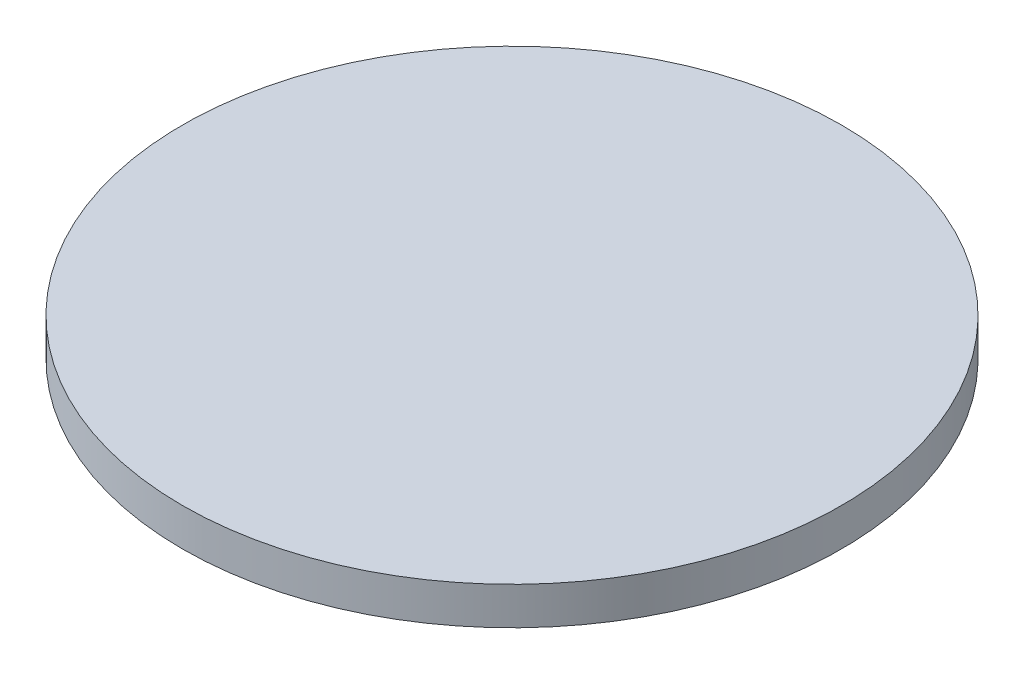
from build123d import *

# Parameters (mm, degrees)
SKETCH1_R           = 87.5
BOSS_EXTRUDE1_DEPTH = 10


with BuildPart() as part:
    # Sketch1 → Boss-Extrude1 (new body)
    with BuildSketch(Plane(origin=(0, 0, 0), x_dir=(1, 0, 0), z_dir=(0, 1, 0))):
        with Locations(Location((0, 0, 0), (0, 0, 270))):
            Circle(SKETCH1_R)
    extrude(amount=BOSS_EXTRUDE1_DEPTH)


solid = part.part
